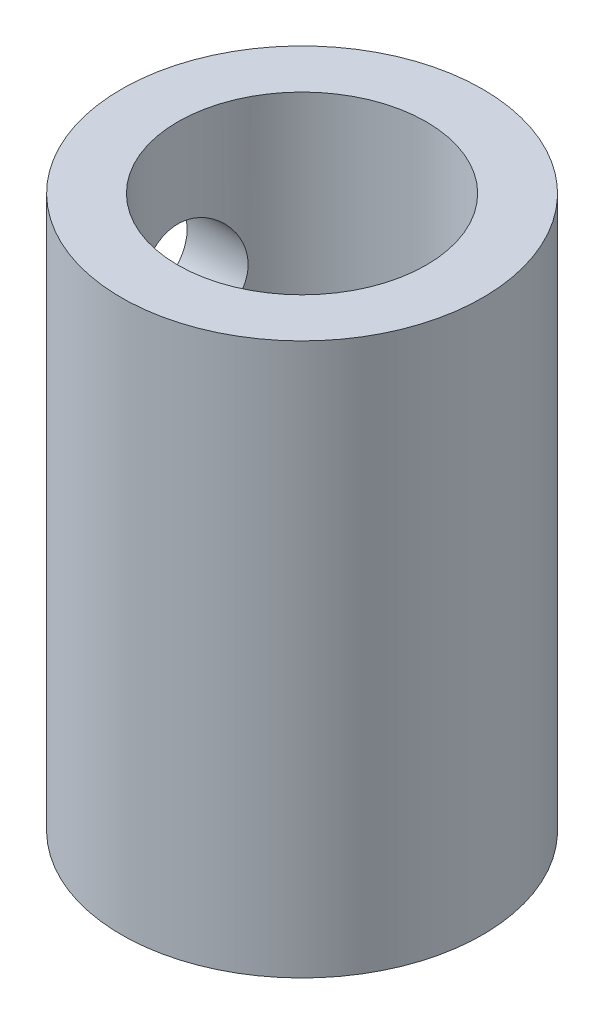
from build123d import *

# Parameters (mm, degrees)
CUT_EXTRUDE1_REACH      = 18.155
CUT_EXTRUDE1_END_RADIUS = 4.8
SKETCH2_R               = 1.505


with BuildPart() as part:
    # Sketch1 → Revolve1 (revolve)
    with BuildSketch(Plane.XY, mode=Mode.PRIVATE) as revolve1_sk:
        Polygon((2.955, 4), (2.955, 0), (4.8, 0), (4.8, 14.66), (3.3, 14.66), (3.3, 5.3), (0, 5.3), (0, 5), (1.515, 5), (1.515, 4), align=None)
    revolve(revolve1_sk.sketch.rotate(Axis((0, 0, 0), (0, 1, 0)), 90), axis=Axis((0, 0, 0), (0, 1, 0)))

    # Cut-Extrude1: up to this cylinder (the profile starts inside it)
    cut_extrude1_end = Plane(origin=(0, 10.803747, 0), z_dir=(0, -1, 0)) * Cylinder(CUT_EXTRUDE1_END_RADIUS, 46.91, mode=Mode.PRIVATE)
    # Sketch2 → Cut-Extrude1 (cut, up to the surface)
    with BuildSketch(Plane(origin=(0, 0, 0), x_dir=(0, 0, -1), z_dir=(1, 0, 0)), mode=Mode.PRIVATE) as cut_extrude1_sk1:
        with Locations((0, 10.803746972)):
            Circle(SKETCH2_R)
    cut_extrude1_tool1 = extrude(cut_extrude1_sk1.sketch, amount=-CUT_EXTRUDE1_REACH, mode=Mode.PRIVATE) & cut_extrude1_end
    add(cut_extrude1_tool1.solids().sort_by_distance((0, 10.803747, 0))[0], mode=Mode.SUBTRACT)


solid = part.part
